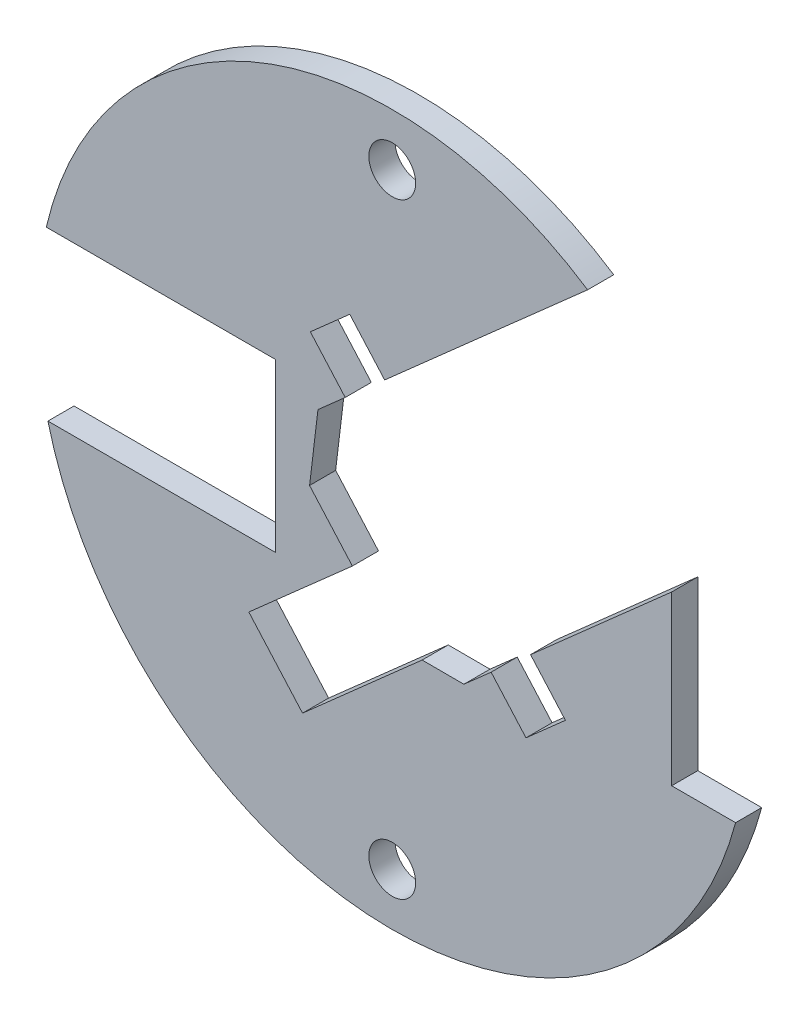
from build123d import *

# Parameters (mm, degrees)
SKETCH1_R           = 1.4224
BOSS_EXTRUDE1_DEPTH = 1.5875
CUT_EXTRUDE3_DEPTH  = 31.574112518
CUT_EXTRUDE4_DEPTH  = 31.574112518


with BuildPart() as part:
    # Sketch1 → Boss-Extrude1 (new body)
    with BuildSketch(Plane.XY):
        with BuildLine():
            Line((-2.425370717, -3.662361234), (-5.027565338, -0.720652536))
            Line((-5.027565338, -0.720652536), (-4.515281158, 3.5306))
            Line((-4.515281158, 3.5306), (-2.860140414, 4.994714494))
            Line((-2.860140414, 4.994714494), (-4.980602482, 7.391837931))
            Line((-4.980602482, 7.391837931), (-2.583479045, 9.5123))
            Line((-2.583479045, 9.5123), (-0.463016976, 7.115176563))
            Line((-0.463016976, 7.115176563), (11.876076152, 18.030166811))
            ThreePointArc((11.876076152, 18.030166811), (-16.886200405, -13.453041882), (20.228041911, 7.546815251))
            Line((20.228041911, 7.546815251), (8.405899773, -2.910887338))
            Line((8.405899773, -2.910887338), (10.526361842, -5.308010776))
            Line((10.526361842, -5.308010776), (8.129238404, -7.428472845))
            Line((8.129238404, -7.428472845), (6.008776335, -5.031349407))
            Line((6.008776335, -5.031349407), (4.353635591, -6.495463901))
            Line((4.353635591, -6.495463901), (1.815981702, -6.489359631))
            Line((1.815981702, -6.489359631), (-5.455454601, -12.9215711))
            Line((-5.455454601, -12.9215711), (-8.720293025, -9.230761998))
            Line((-8.720293025, -9.230761998), (-2.425370717, -3.662361234))
        make_face()
        with Locations((0, -18.415)):
            Circle(SKETCH1_R, mode=Mode.SUBTRACT)
        with Locations((0, 18.415)):
            Circle(SKETCH1_R, mode=Mode.SUBTRACT)
    extrude(amount=BOSS_EXTRUDE1_DEPTH)

    # Sketch2 → Cut-Extrude3 (cut, through all)
    with BuildSketch(Plane.XY.offset(1.5875)):
        with BuildLine():
            Line((-7.084965338, 4.8768), (-21.031997569, 4.8768))
            ThreePointArc((-21.031997569, 4.8768), (-21.588987692, -0.209070373), (-20.933606898, -5.2832))
            Line((-20.933606898, -5.2832), (-7.084965338, -5.2832))
            Line((-7.084965338, -5.2832), (-7.084965338, 4.8768))
        make_face()
    extrude(amount=-CUT_EXTRUDE3_DEPTH, mode=Mode.SUBTRACT)

    # Sketch3 → Cut-Extrude4 (cut, through all)
    with BuildSketch(Plane(origin=(0, 0, 0), x_dir=(-1, 0, 0), z_dir=(0, 0, -1))):
        with BuildLine():
            Line((-20.871224203, -5.5245), (-16.984058744, -5.5245))
            Line((-16.984058744, -5.5245), (-16.984058744, 4.677232838))
            Line((-16.984058744, 4.677232838), (-20.228041911, 7.546815251))
            ThreePointArc((-20.228041911, 7.546815251), (-21.563910577, 1.061065789), (-20.871224203, -5.5245))
        make_face()
    extrude(amount=-CUT_EXTRUDE4_DEPTH, mode=Mode.SUBTRACT)


solid = part.part
